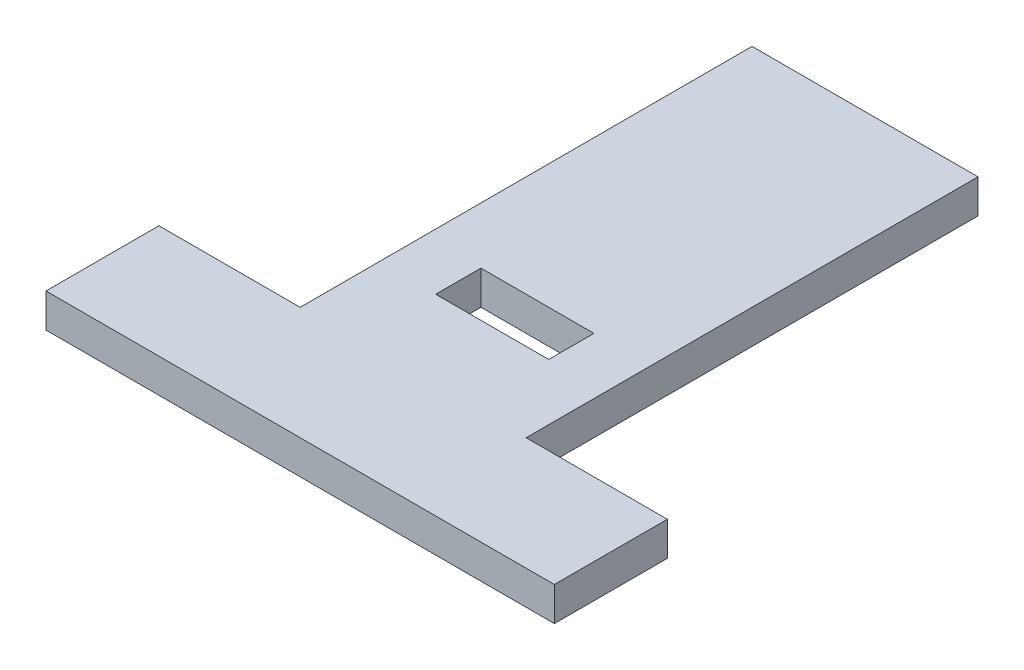
from build123d import *

# Parameters (mm, degrees)
SKETCH1_W           = 45
SKETCH1_H           = 50
BOSS_EXTRUDE1_DEPTH = 3
SKETCH4_W           = 12.5
SKETCH4_H           = 40.003655499
SKETCH4_H_2         = 40
SKETCH4_W_2         = 10
SKETCH4_H_3         = 4
CUT_EXTRUDE1_DEPTH  = 3


with BuildPart() as part:
    # Sketch1 → Boss-Extrude1 (new body)
    with BuildSketch(Plane(origin=(0, 0, 0), x_dir=(1, 0, 0), z_dir=(0, 1, 0))):
        Rectangle(SKETCH1_W, SKETCH1_H)
    extrude(amount=BOSS_EXTRUDE1_DEPTH)

    # Sketch4 → Cut-Extrude1 (cut)
    with BuildSketch(Plane(origin=(0, 3, 0), x_dir=(1, 0, 0), z_dir=(0, 1, 0))):
        with Locations((-16.25, 4.99817225)):
            Rectangle(SKETCH4_W, SKETCH4_H)
        with Locations((16.25, 5)):
            Rectangle(SKETCH4_W, SKETCH4_H_2)
        with Locations((0, -6)):
            Rectangle(SKETCH4_W_2, SKETCH4_H_3)
    extrude(amount=-CUT_EXTRUDE1_DEPTH, mode=Mode.SUBTRACT)


solid = part.part
